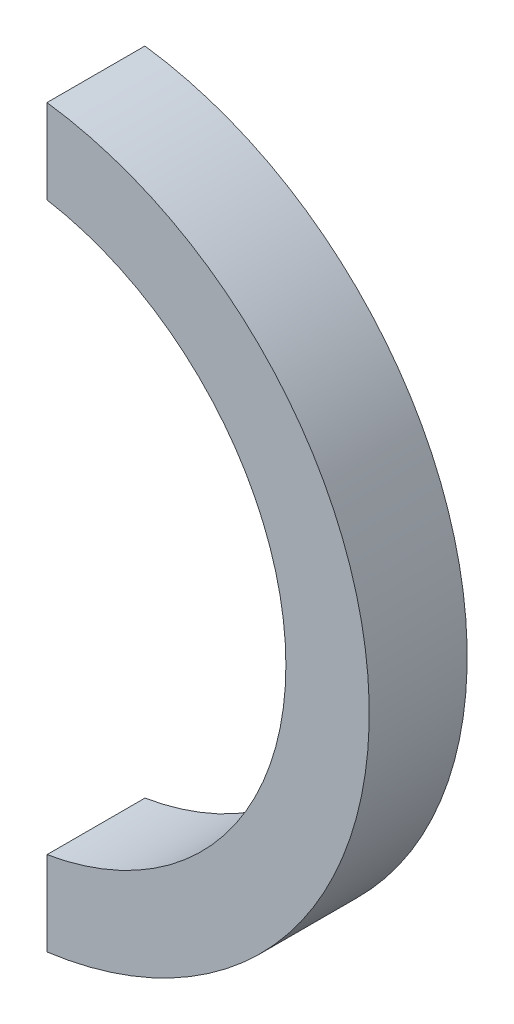
from build123d import *

# Parameters (mm, degrees)
BOSS_EXTRUDE1_DEPTH = 18.966


with BuildPart() as part:
    # Sketch1 → Boss-Extrude1 (new body)
    with BuildSketch(Plane.XY):
        with BuildLine():
            Line((9.4375, 54.898717742), (9.4375, 71.222451648))
            ThreePointArc((9.4375, 71.222451648), (71.845, 0), (9.4375, -71.222451648))
            Line((9.4375, -71.222451648), (9.4375, -54.898717742))
            ThreePointArc((9.4375, -54.898717742), (55.704, 0), (9.4375, 54.898717742))
        make_face()
    extrude(amount=BOSS_EXTRUDE1_DEPTH)


solid = part.part
